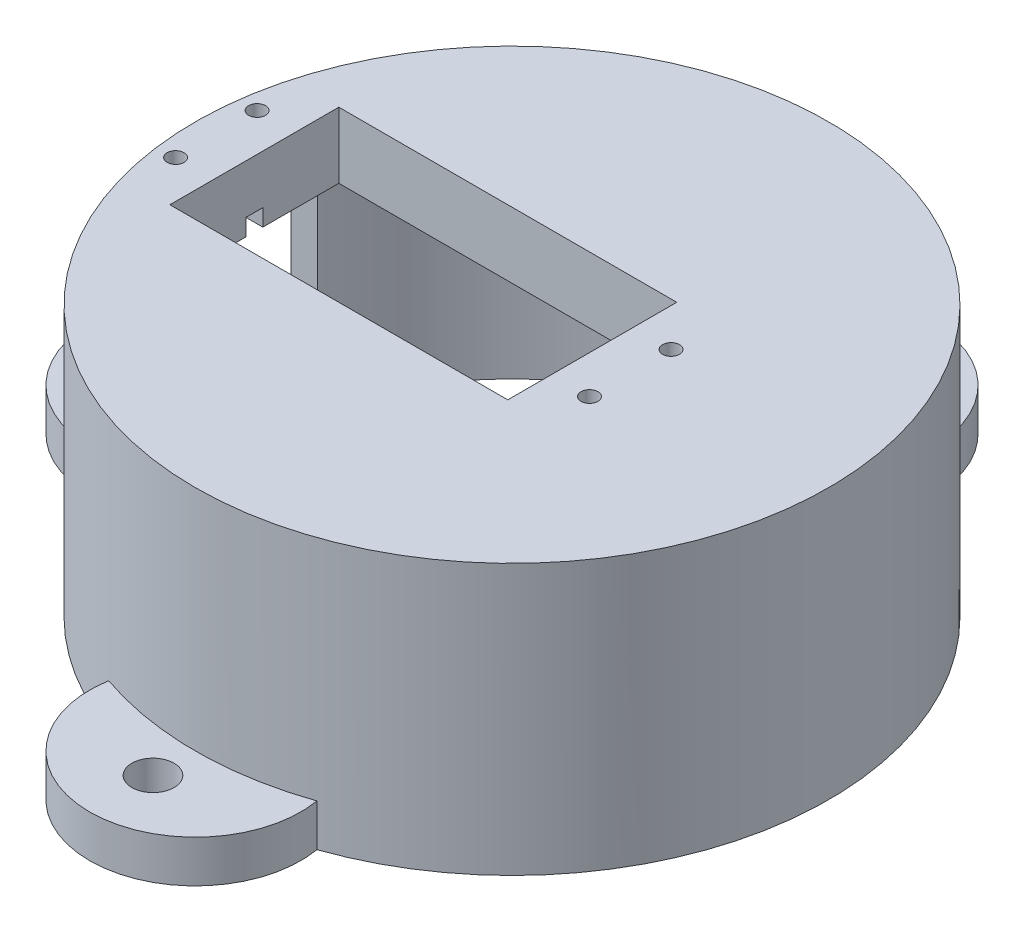
from build123d import *

# Parameters (mm, degrees)
SKETCH1_R           = 2.5
BOSS_EXTRUDE1_DEPTH = 32
SKETCH1_3_R         = 2.5
BOSS_EXTRUDE2_DEPTH = 5
CUT_EXTRUDE1_START  = -32
SKETCH2_R           = 1
SKETCH2_W           = 40
SKETCH2_H           = 20
SKETCH2_R_2         = 2.5
CUT_EXTRUDE1_DEPTH  = 32
CUT_EXTRUDE2_DEPTH  = 24.2
SKETCH4_W           = 5
SKETCH4_H           = 2
CUT_EXTRUDE3_DEPTH  = 2


with BuildPart() as part:
    # Sketch1 → Boss-Extrude1 (new body)
    with BuildSketch(Plane(origin=(0, 0, 0), x_dir=(1, 0, 0), z_dir=(0, 1, 0))):
        with BuildLine():
            ThreePointArc((-35.416666667, 12.325166215), (-37.5, 0), (-35.416666667, -12.325166215))
            ThreePointArc((-35.416666667, -12.325166215), (-26.516504294, -26.516504294), (-12.325166215, -35.416666667))
            ThreePointArc((-12.325166215, -35.416666667), (0, -37.5), (12.325166215, -35.416666667))
            ThreePointArc((12.325166215, -35.416666667), (26.516504294, -26.516504294), (35.416666667, -12.325166215))
            ThreePointArc((35.416666667, -12.325166215), (36.975498644, -6.25), (37.5, 0))
            ThreePointArc((37.5, 0), (36.975498644, 6.25), (35.416666667, 12.325166215))
            ThreePointArc((35.416666667, 12.325166215), (26.516504294, 26.516504294), (12.325166215, 35.416666667))
            ThreePointArc((12.325166215, 35.416666667), (0, 37.5), (-12.325166215, 35.416666667))
            ThreePointArc((-12.325166215, 35.416666667), (-26.516504294, 26.516504294), (-35.416666667, 12.325166215))
        make_face()
        with Locations(Location((0, 0, 0), (0, 0, 270))):
            Circle(SKETCH1_R, mode=Mode.SUBTRACT)
    extrude(amount=BOSS_EXTRUDE1_DEPTH)

    # Sketch1<3> → Boss-Extrude2 (add)
    # profile 1 of 3: a face of its own
    with BuildSketch(Plane(origin=(0, 0, 0), x_dir=(1, 0, 0), z_dir=(0, 1, 0))):
        with BuildLine():
            ThreePointArc((-35.416666667, 12.325166215), (-50, 0), (-35.416666667, -12.325166215))
            ThreePointArc((-35.416666667, -12.325166215), (-37.5, 0), (-35.416666667, 12.325166215))
        make_face()
        with Locations(Location((-42.5, 0, 0), (0, 0, 270))):
            Circle(SKETCH1_3_R, mode=Mode.SUBTRACT)
    # profile 2 of 3: a face of its own
    with BuildSketch(Plane(origin=(0, 0, 0), x_dir=(1, 0, 0), z_dir=(0, 1, 0))):
        with BuildLine():
            ThreePointArc((12.325166215, -35.416666667), (0, -37.5), (-12.325166215, -35.416666667))
            ThreePointArc((-12.325166215, -35.416666667), (0, -50), (12.325166215, -35.416666667))
        make_face()
        with Locations(Location((0, -42.5, 0), (0, 0, 270))):
            Circle(SKETCH1_3_R, mode=Mode.SUBTRACT)
    # profile 3 of 3: a face of its own
    with BuildSketch(Plane(origin=(0, 0, 0), x_dir=(1, 0, 0), z_dir=(0, 1, 0))):
        with BuildLine():
            ThreePointArc((12.325166215, 35.416666667), (0, 50), (-12.325166215, 35.416666667))
            ThreePointArc((-12.325166215, 35.416666667), (0, 37.5), (12.325166215, 35.416666667))
        make_face()
        with Locations(Location((0, 42.5, 0), (0, 0, 270))):
            Circle(SKETCH1_3_R, mode=Mode.SUBTRACT)
    extrude(amount=BOSS_EXTRUDE2_DEPTH)

    # Sketch2 → Cut-Extrude1 (cut)
    # profile 1 of 5: a face of its own
    with BuildSketch(Plane(origin=(0, 32, 0), x_dir=(1, 0, 0), z_dir=(0, 1, 0)).offset(CUT_EXTRUDE1_START)):
        with Locations(Location((-35, 4.825, 0), (0, 0, 270))):
            Circle(SKETCH2_R)
    # profile 2 of 5: a face of its own
    with BuildSketch(Plane(origin=(0, 32, 0), x_dir=(1, 0, 0), z_dir=(0, 1, 0)).offset(CUT_EXTRUDE1_START)):
        with Locations(Location((-35, -4.825, 0), (0, 0, 270))):
            Circle(SKETCH2_R)
    # profile 3 of 5: a face of its own
    with BuildSketch(Plane(origin=(0, 32, 0), x_dir=(1, 0, 0), z_dir=(0, 1, 0)).offset(CUT_EXTRUDE1_START)):
        with Locations(Location((14, 4.825, 0), (0, 0, 270))):
            Circle(SKETCH2_R)
    # profile 4 of 5: a face of its own
    with BuildSketch(Plane(origin=(0, 32, 0), x_dir=(1, 0, 0), z_dir=(0, 1, 0)).offset(CUT_EXTRUDE1_START)):
        with Locations(Location((14, -4.825, 0), (0, 0, 270))):
            Circle(SKETCH2_R)
    # profile 5 of 5: a face of its own
    with BuildSketch(Plane(origin=(0, 32, 0), x_dir=(1, 0, 0), z_dir=(0, 1, 0)).offset(CUT_EXTRUDE1_START)):
        with Locations((-10.5, 0)):
            Rectangle(SKETCH2_W, SKETCH2_H)
        Circle(SKETCH2_R_2, mode=Mode.SUBTRACT)
    extrude(amount=CUT_EXTRUDE1_DEPTH, mode=Mode.SUBTRACT)

    # Sketch3 → Cut-Extrude2 (cut)
    with BuildSketch(Plane(origin=(0, 0, 0), x_dir=(-1, 0, 0), z_dir=(0, -1, 0))):
        with BuildLine():
            Line((33.018933962, -10), (38.018933962, -10))
            Line((38.018933962, -10), (38.018933962, 10))
            Line((38.018933962, 10), (33.018933962, 10))
            ThreePointArc((33.018933962, 10), (-34.5, 0), (33.018933962, -10))
        make_face()
    extrude(amount=-CUT_EXTRUDE2_DEPTH, mode=Mode.SUBTRACT)

    # Sketch4 → Cut-Extrude3 (cut)
    with BuildSketch(Plane(origin=(0, 24.2, 0), x_dir=(-1, 0, 0), z_dir=(0, -1, 0))):
        with Locations((-12, 0)):
            Rectangle(SKETCH4_W, SKETCH4_H)
        with Locations((33, 0)):
            Rectangle(SKETCH4_W, SKETCH4_H)
    extrude(amount=-CUT_EXTRUDE3_DEPTH, mode=Mode.SUBTRACT)


solid = part.part
